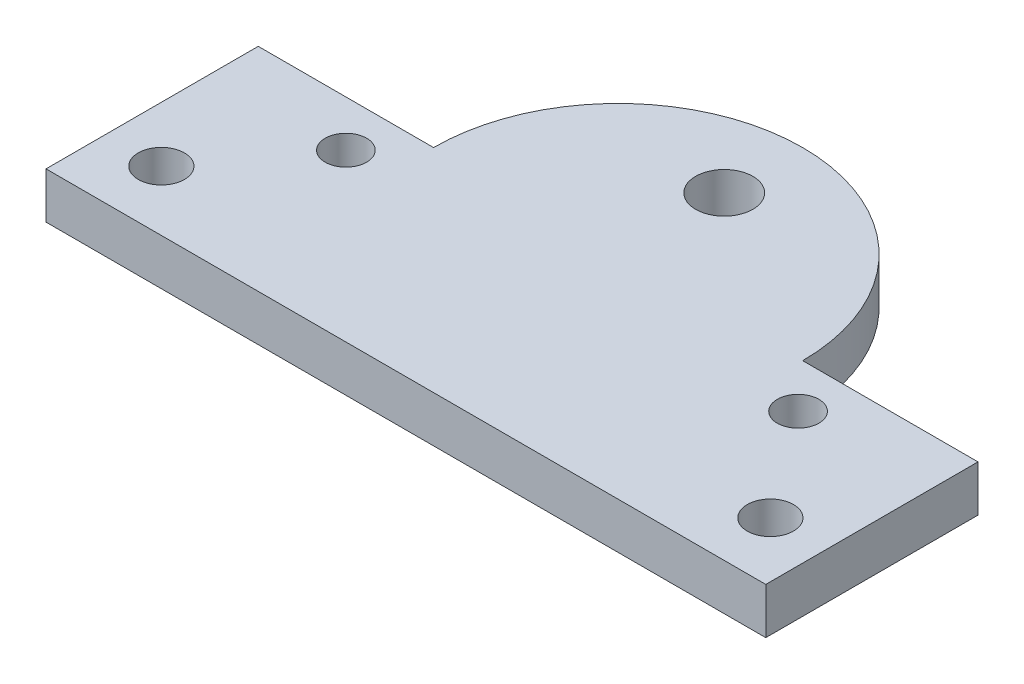
from build123d import *

# Parameters (mm, degrees)
IZIM1_R                     = 3.1
IZIM1_R_2                   = 2.25
IZIM1_R_3                   = 2.5
Y_KSEKLIK_EKSTR_ZYON1_DEPTH = 5


with BuildPart() as part:
    # Çizim1 → Yükseklik-Ekstrüzyon1 (new body)
    with BuildSketch(Plane(origin=(0, 0, 0), x_dir=(1, 0, 0), z_dir=(0, 1, 0))):
        with BuildLine():
            Line((-39, 11.5), (-20, 11.5))
            ThreePointArc((-20, 11.5), (0, 31.5), (20, 11.5))
            Line((20, 11.5), (39, 11.5))
            Line((39, 11.5), (39, -11.5))
            Line((39, -11.5), (-39, -11.5))
            Line((-39, -11.5), (-39, 11.5))
        make_face()
        with Locations(Location((0, 23, 0), (0, 0, 270))):
            Circle(IZIM1_R, mode=Mode.SUBTRACT)
        with Locations(Location((-24.5, 6.5, 0), (0, 0, 270))):
            Circle(IZIM1_R_2, mode=Mode.SUBTRACT)
        with Locations(Location((-33, -5, 0), (0, 0, 270))):
            Circle(IZIM1_R_3, mode=Mode.SUBTRACT)
        with Locations(Location((33, -5, 0), (0, 0, 90))):
            Circle(IZIM1_R_3, mode=Mode.SUBTRACT)
        with Locations(Location((24.5, 6.5, 0), (0, 0, 90))):
            Circle(IZIM1_R_2, mode=Mode.SUBTRACT)
    extrude(amount=Y_KSEKLIK_EKSTR_ZYON1_DEPTH)


solid = part.part
